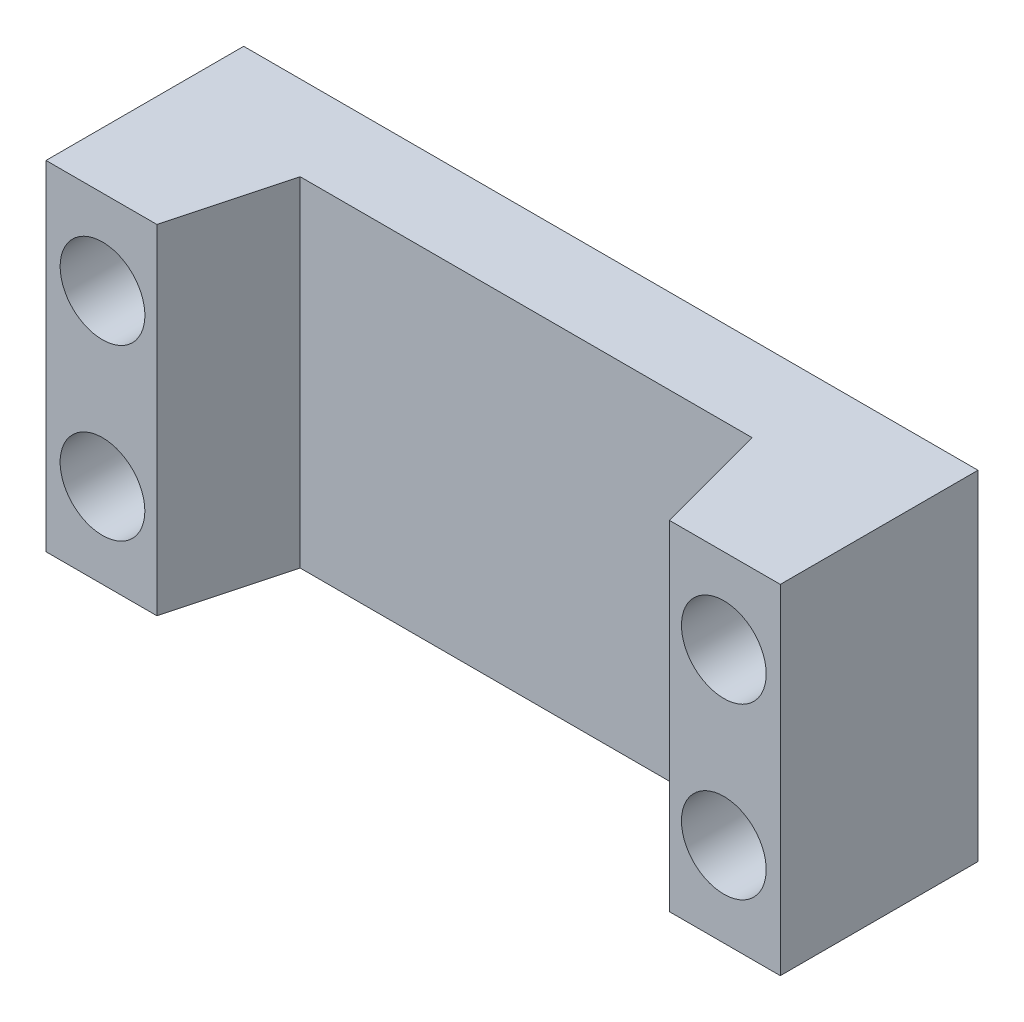
from build123d import *

# Parameters (mm, degrees)
EXTRUDE_1_DEPTH     = 12
SKETCH_3_W          = 26
SKETCH_3_H          = 12
CUT_EXTRUDE_1_DEPTH = 2
SKETCH_4_R          = 1.5
CUT_EXTRUDE_2_DEPTH = 7


with BuildPart() as part:
    # 草图2 → 凸台-拉伸1 (new body)
    with BuildSketch(Plane(origin=(0, 0, 0), x_dir=(1, 0, 0), z_dir=(0, 1, 0))):
        Polygon((-13, 0), (-9.07179677, 0), (-8, 4), (8, 4), (9.07179677, 0), (13, 0), (13, 9), (-13, 9), align=None)
    extrude(amount=EXTRUDE_1_DEPTH)

    # 草图3 → 切除-拉伸1 (cut)
    with BuildSketch(Plane(origin=(0, 0, -9), x_dir=(-1, 0, 0), z_dir=(0, 0, -1))):
        with Locations((0, 6)):
            Rectangle(SKETCH_3_W, SKETCH_3_H)
    extrude(amount=-CUT_EXTRUDE_1_DEPTH, mode=Mode.SUBTRACT)

    # 草图4 → 切除-拉伸2 (cut)
    with BuildSketch(Plane(origin=(0, 0, -7), x_dir=(-1, 0, 0), z_dir=(0, 0, -1))):
        with Locations((-11, 3)):
            Circle(SKETCH_4_R)
        with Locations(Location((11, 3, 0), (0, 0, 180))):
            Circle(SKETCH_4_R)
        with Locations((11, 9)):
            Circle(SKETCH_4_R)
        with Locations(Location((-11, 9, 0), (0, 0, 180))):
            Circle(SKETCH_4_R)
    extrude(amount=-CUT_EXTRUDE_2_DEPTH, mode=Mode.SUBTRACT)


solid = part.part
